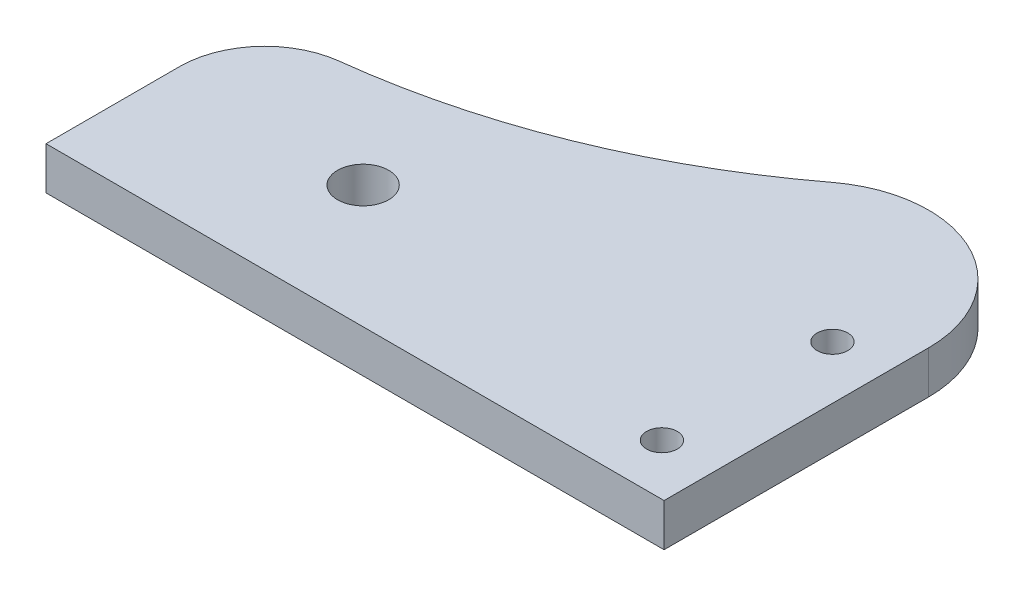
from build123d import *

# Parameters (mm, degrees)
BOSS_EXTRUDE1_DEPTH = 6.35
FILLET1_R           = 12.7
SKETCH2_R           = 2.286
CUT_EXTRUDE1_DEPTH  = 127.107467202
SKETCH3_R           = 3.81
CUT_EXTRUDE2_DEPTH  = 127.107467202
FILLET2_R           = 17.78


with BuildPart() as part:
    # Sketch1 → Boss-Extrude1 (new body)
    with BuildSketch(Plane(origin=(0, 0, 0), x_dir=(1, 0, 0), z_dir=(0, 1, 0))):
        with BuildLine():
            Line((0, 0), (92.075, 0))
            Line((92.075, 0), (92.075, 85.93582))
            ThreePointArc((92.075, 85.93582), (53.210726842, 46.653837999), (0, 31.75))
            Line((0, 31.75), (0, 0))
        make_face()
    extrude(amount=BOSS_EXTRUDE1_DEPTH)

    # Fillet1
    fillet1_edges = [part.edges().sort_by_distance(p)[0] for p in [
        (0, 3.175, -31.75),
    ]]
    fillet(fillet1_edges, radius=FILLET1_R)

    # Sketch2 → Cut-Extrude1 (cut, through all)
    with BuildSketch(Plane(origin=(0, 6.35, 0), x_dir=(1, 0, 0), z_dir=(0, 1, 0))):
        with Locations(Location((84.1375, 7.62, 0), (0, 0, 270))):
            Circle(SKETCH2_R)
        with Locations(Location((84.1375, 33.02, 0), (0, 0, 270))):
            Circle(SKETCH2_R)
    extrude(amount=-CUT_EXTRUDE1_DEPTH, mode=Mode.SUBTRACT)

    # Sketch3 → Cut-Extrude2 (cut, through all)
    with BuildSketch(Plane(origin=(0, 6.35, 0), x_dir=(1, 0, 0), z_dir=(0, 1, 0))):
        with Locations(Location((28.956, 18.288, 0), (0, 0, 270))):
            Circle(SKETCH3_R)
    extrude(amount=-CUT_EXTRUDE2_DEPTH, mode=Mode.SUBTRACT)

    # Fillet2
    fillet2_edges = [part.edges().sort_by_distance(p)[0] for p in [
        (92.075, 3.175, -85.93582),
    ]]
    fillet(fillet2_edges, radius=FILLET2_R)


solid = part.part
